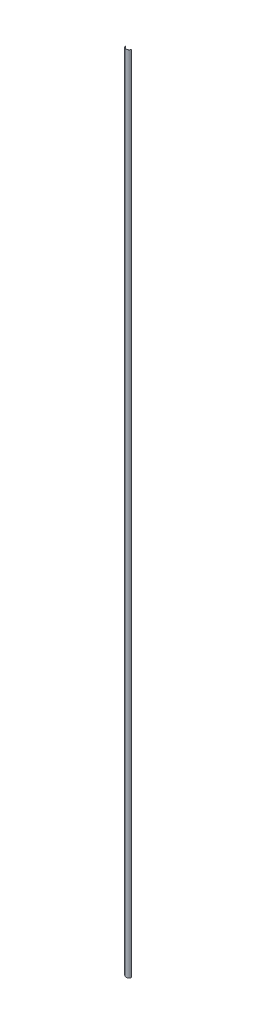
from build123d import *

# Parameters (mm, degrees)
SKETCH1_W           = 90
SKETCH1_H           = 90
BOSS_EXTRUDE1_DEPTH = 5
BOSS_EXTRUDE2_DEPTH = 2005
SKETCH3_W           = 90
SKETCH3_H           = 90
CUT_EXTRUDE3_DEPTH  = 5


with BuildPart() as part:
    # Sketch1 → Boss-Extrude1 (new body)
    with BuildSketch(Plane(origin=(0, 0, 0), x_dir=(1, 0, 0), z_dir=(0, 1, 0))):
        Rectangle(SKETCH1_W, SKETCH1_H)
    extrude(amount=BOSS_EXTRUDE1_DEPTH)

    # Sketch2 → Boss-Extrude2 (add)
    with BuildSketch(Plane.XZ):
        with BuildLine():
            Line((-7.519680062, 1.976929803), (-7.419680062, 1.976929803))
            ThreePointArc((-7.419680062, 1.976929803), (-0.074747151, 7.678171432), (7.379786606, 2.121002904))
            Line((7.379786606, 2.121002904), (7.480319938, 2.121002904))
            ThreePointArc((7.480319938, 2.121002904), (-0.074676432, 7.774848109), (-7.519680062, 1.976929803))
        make_face()
    extrude(amount=BOSS_EXTRUDE2_DEPTH)

    # Sketch3 → Cut-Extrude3 (cut)
    with BuildSketch(Plane(origin=(0, 5, 0), x_dir=(1, 0, 0), z_dir=(0, 1, 0))):
        Rectangle(SKETCH3_W, SKETCH3_H)
    extrude(amount=-CUT_EXTRUDE3_DEPTH, mode=Mode.SUBTRACT)


solid = part.part
